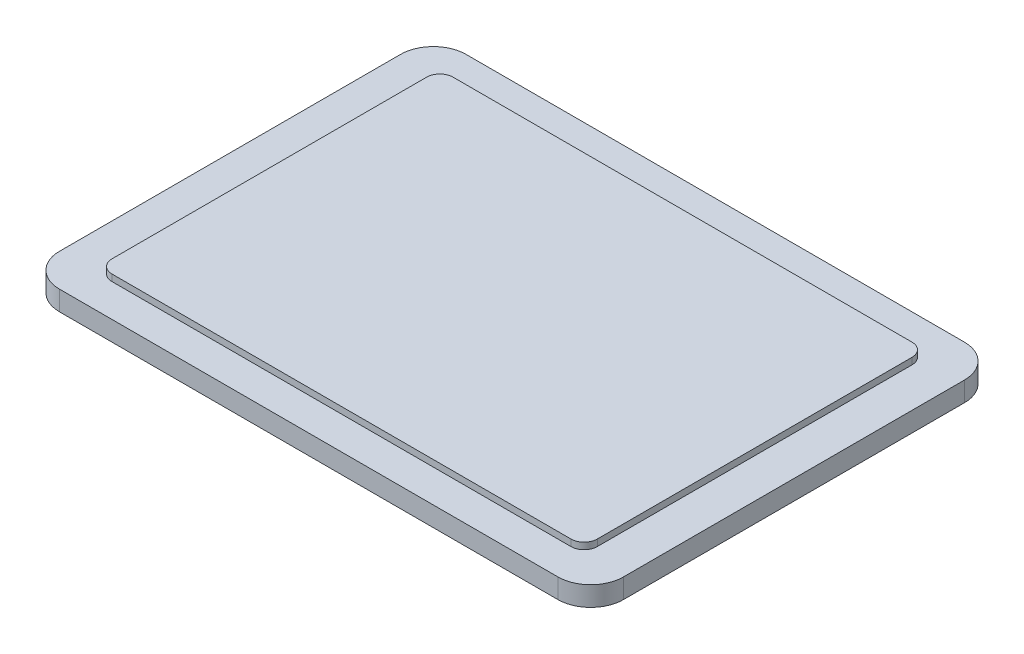
from build123d import *

# Parameters (mm, degrees)
SKETCH_1_W      = 86
SKETCH_1_H      = 62
EXTRUDE_1_DEPTH = 3
SKETCH_2_W      = 74
SKETCH_2_H      = 52
EXTRUDE_2_DEPTH = 1
FILLET_1_R      = 5
FILLET_2_R      = 2


with BuildPart() as part:
    # 草图1 → 凸台-拉伸1 (new body)
    with BuildSketch(Plane(origin=(0, 0, 0), x_dir=(1, 0, 0), z_dir=(0, 1, 0))):
        Rectangle(SKETCH_1_W, SKETCH_1_H)
    extrude(amount=EXTRUDE_1_DEPTH)

    # 草图2 → 凸台-拉伸2 (add)
    with BuildSketch(Plane(origin=(0, 3, 0), x_dir=(1, 0, 0), z_dir=(0, 1, 0))):
        Rectangle(SKETCH_2_W, SKETCH_2_H)
    extrude(amount=EXTRUDE_2_DEPTH)

    # 圆角1
    fillet_1_edges = [part.edges().sort_by_distance(p)[0] for p in [
        (-43, 1.5, -31),
        (43, 1.5, -31),
        (43, 1.5, 31),
        (-43, 1.5, 31),
    ]]
    fillet(fillet_1_edges, radius=FILLET_1_R)

    # 圆角2
    fillet_2_edges = [part.edges().sort_by_distance(p)[0] for p in [
        (-37, 3.5, -26),
        (-37, 3.5, 26),
        (37, 3.5, 26),
        (37, 3.5, -26),
    ]]
    fillet(fillet_2_edges, radius=FILLET_2_R)


solid = part.part
